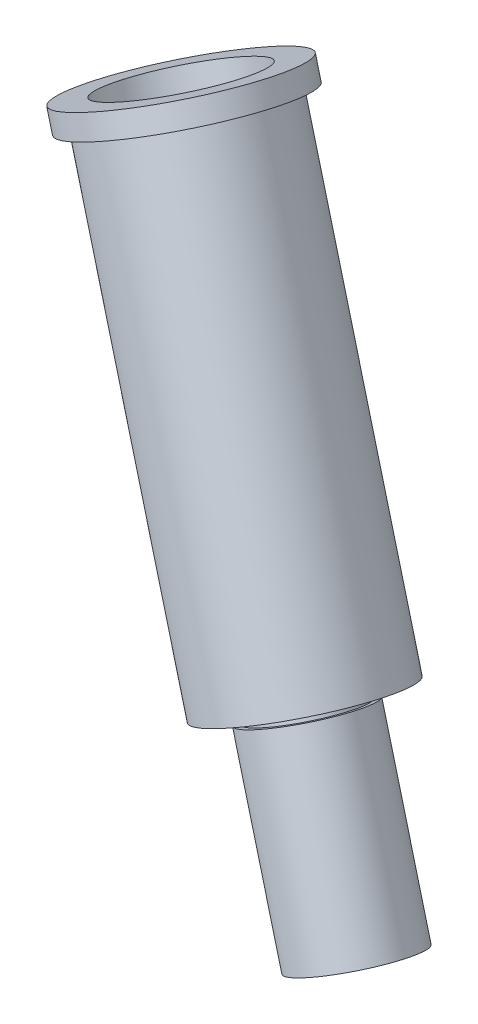
from build123d import *

# Parameters (mm, degrees)
SKETCH1_R           = 11.43
BOSS_EXTRUDE1_DEPTH = 2.54
SKETCH2_R           = 9.9949
BOSS_EXTRUDE2_DEPTH = 50.8
SKETCH3_R           = 5.715
BOSS_EXTRUDE3_DEPTH = 1.016
SKETCH4_R           = 6.35
BOSS_EXTRUDE4_DEPTH = 21.336
SKETCH5_R           = 3.175
CUT_EXTRUDE1_DEPTH  = 99.13815411
SKETCH6_R           = 7.9375
CUT_EXTRUDE2_DEPTH  = 38.1


with BuildPart() as part:
    # Sketch1 → Boss-Extrude1 (new body)
    with BuildSketch(Plane(origin=(-129.203450499, 253.122013832, -50.271342949), x_dir=(0.8839119577418659, 0.40461078724322996, -0.23449895907520743), z_dir=(-0.4476862825736014, 0.8770605813697528, -0.1741887740435096))):
        with Locations(Location((-31.085661697, -28.519102589, 0), (0, 0, 166.223237714))):
            Circle(SKETCH1_R)
    extrude(amount=BOSS_EXTRUDE1_DEPTH)

    # Sketch2 → Boss-Extrude2 (add)
    with BuildSketch(Plane(origin=(-129.203450499, 253.122013832, -50.271342949), x_dir=(-0.8839119577418658, -0.4046107872432301, 0.23449895907520704), z_dir=(0.44768628257360144, -0.8770605813697528, 0.17418877404350955))):
        with Locations(Location((31.085661697, -28.519102589, 0), (0, 0, 13.776762286))):
            Circle(SKETCH2_R)
    extrude(amount=BOSS_EXTRUDE2_DEPTH)

    # Sketch3 → Boss-Extrude3 (add)
    with BuildSketch(Plane(origin=(-106.460987345, 208.567336298, -41.422553227), x_dir=(-0.8839119577418658, -0.40461078724323, 0.2344989590752073), z_dir=(0.44768628257360144, -0.8770605813697528, 0.17418877404350946))):
        with Locations(Location((31.085661697, -28.519102589, 0), (0, 0, 193.776762286))):
            Circle(SKETCH3_R)
    extrude(amount=BOSS_EXTRUDE3_DEPTH)

    # Sketch4 → Boss-Extrude4 (add)
    with BuildSketch(Plane(origin=(-106.006138081, 207.676242747, -41.245577433), x_dir=(-0.8839119577418657, -0.40461078724322985, 0.23449895907520799), z_dir=(0.4476862825736014, -0.8770605813697527, 0.1741887740435095))):
        with Locations(Location((31.085661697, -28.519102589, 0), (0, 0, 193.776762286))):
            Circle(SKETCH4_R)
    extrude(amount=BOSS_EXTRUDE4_DEPTH)

    # Sketch5 → Cut-Extrude1 (cut, through all)
    with BuildSketch(Plane(origin=(-130.340573657, 255.349747708, -50.713782435), x_dir=(0.8839119577418658, 0.40461078724323, -0.2344989590752073), z_dir=(-0.4476862825736014, 0.8770605813697528, -0.1741887740435095))):
        with Locations(Location((-31.085661697, -28.519102589, 0), (0, 0, 166.223237714))):
            Circle(SKETCH5_R)
    extrude(amount=-CUT_EXTRUDE1_DEPTH, mode=Mode.SUBTRACT)

    # Sketch6 → Cut-Extrude2 (cut)
    with BuildSketch(Plane(origin=(-130.340573657, 255.349747708, -50.713782435), x_dir=(0.8839119577418658, 0.40461078724323, -0.2344989590752073), z_dir=(-0.4476862825736014, 0.8770605813697528, -0.1741887740435095))):
        with Locations(Location((-31.085661697, -28.519102589, 0), (0, 0, 166.223237714))):
            Circle(SKETCH6_R)
    extrude(amount=-CUT_EXTRUDE2_DEPTH, mode=Mode.SUBTRACT)


solid = part.part
